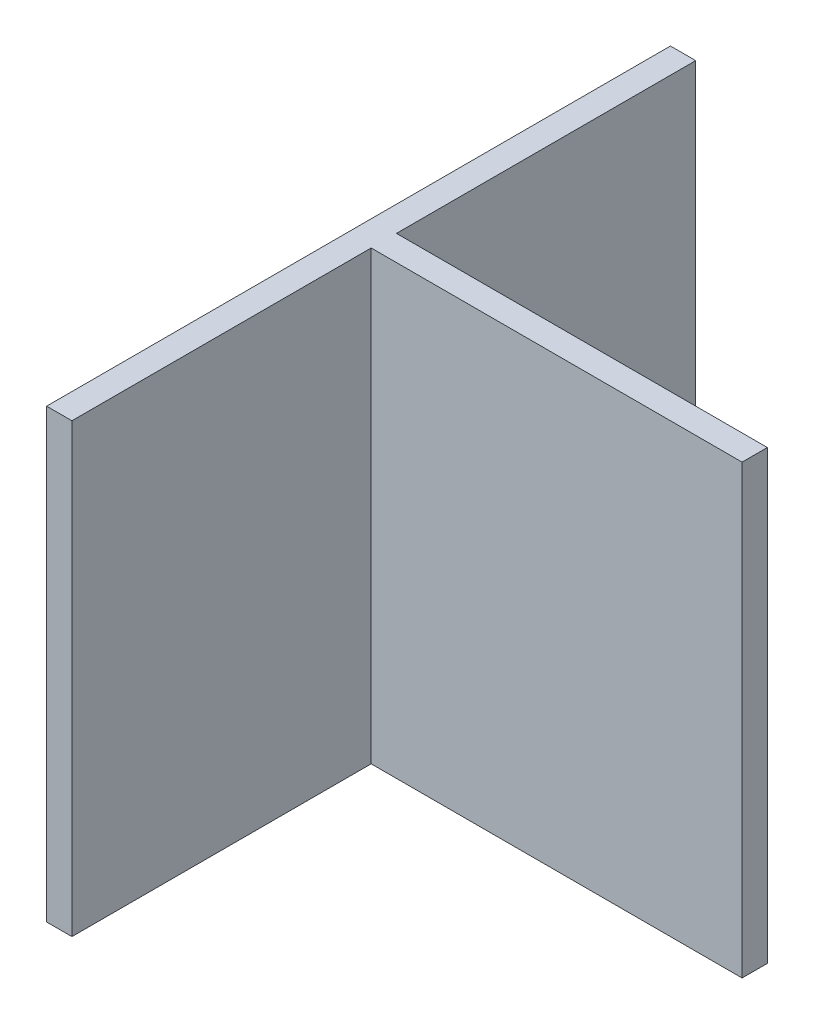
from build123d import *

# Parameters (mm, degrees)
SKETCH1_W           = 152.4
SKETCH1_H           = 3759.2
SKETCH1_W_2         = 2235.2
SKETCH1_H_2         = 152.4
BOSS_EXTRUDE1_DEPTH = 2692.4


with BuildPart() as part:
    # Sketch1 → Boss-Extrude1 (new body)
    with BuildSketch(Plane(origin=(0, 0, 0), x_dir=(1, 0, 0), z_dir=(0, 1, 0))):
        Rectangle(SKETCH1_W, SKETCH1_H)
        with Locations((1193.8, 0)):
            Rectangle(SKETCH1_W_2, SKETCH1_H_2)
    extrude(amount=BOSS_EXTRUDE1_DEPTH)


solid = part.part
